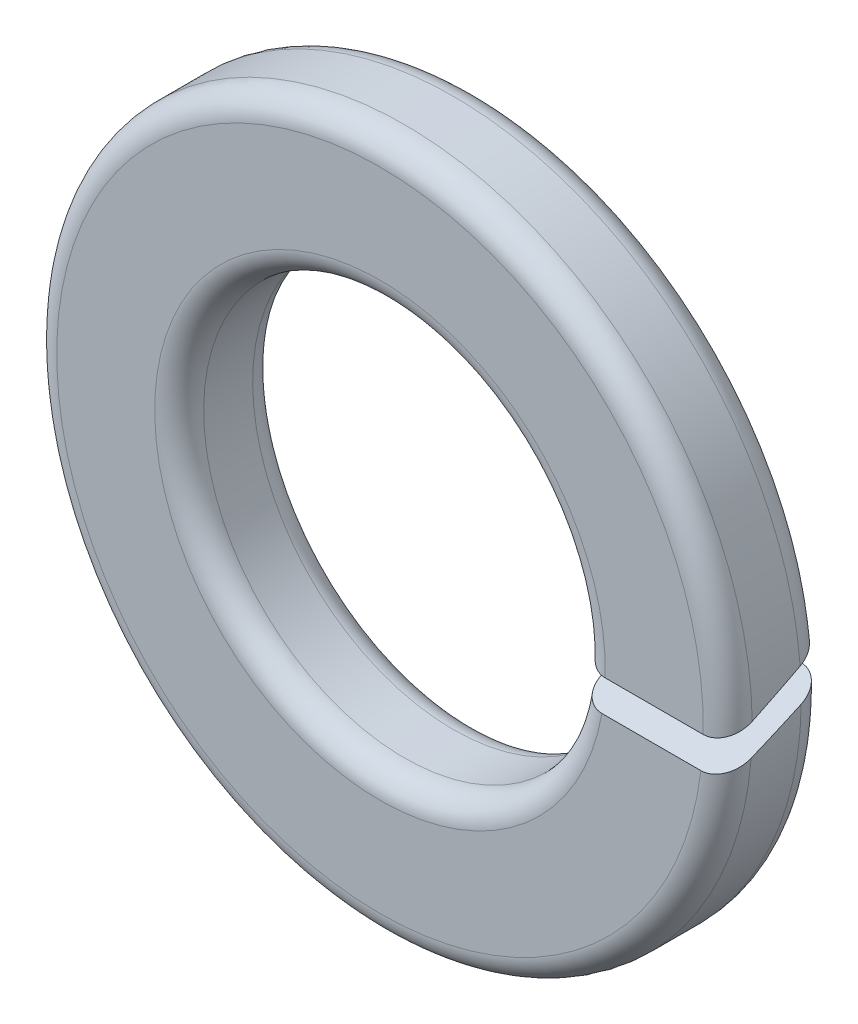
from build123d import *

# Parameters (mm, degrees)
SKICA1_R                 = 7.1
SKICA1_R_2               = 4.1
VYSUNOUT1_DEPTH          = 2
ZAOBLIT1_R               = 0.5
ODEBRAT_VYSUNUT_M1_DEPTH = 11.238163967


with BuildPart() as part:
    # Skica1 → Vysunout1 (new body)
    with BuildSketch(Plane.XY):
        Circle(SKICA1_R)
        Circle(SKICA1_R_2, mode=Mode.SUBTRACT)
    extrude(amount=VYSUNOUT1_DEPTH)

    # Zaoblit1
    zaoblit1_edges = [part.edges().sort_by_distance(p)[0] for p in [
        (-7.1, 0, 0),
        (-7.1, 0, 2),
        (-4.1, 0, 0),
        (-4.1, 0, 2),
    ]]
    fillet(zaoblit1_edges, radius=ZAOBLIT1_R)

    # Skica2 → Odebrat vysunutím1 (cut, through all)
    with BuildSketch(Plane(origin=(0, 0, 0), x_dir=(0, 0, -1), z_dir=(1, 0, 0))):
        Polygon((0, 0.135294282), (-2, -0.797321034), (-2, -0.135294282), (0, 0.797321034), align=None)
    extrude(amount=ODEBRAT_VYSUNUT_M1_DEPTH, mode=Mode.SUBTRACT)


solid = part.part
